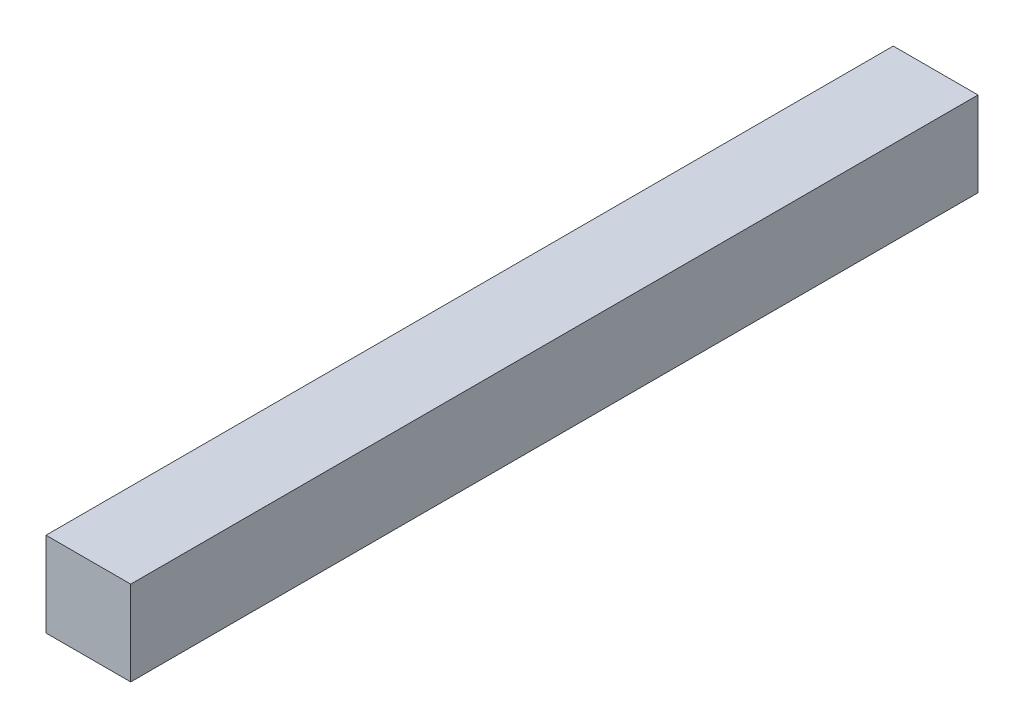
from build123d import *

# Parameters (mm, degrees)
ESQUISSE1_W        = 10
ESQUISSE1_H        = 10
BOSS_EXTRU_1_DEPTH = 100


with BuildPart() as part:
    # Esquisse1 → Boss.-Extru.1 (new body)
    with BuildSketch(Plane.XY):
        with Locations((5, 5)):
            Rectangle(ESQUISSE1_W, ESQUISSE1_H)
    extrude(amount=BOSS_EXTRU_1_DEPTH)


solid = part.part
